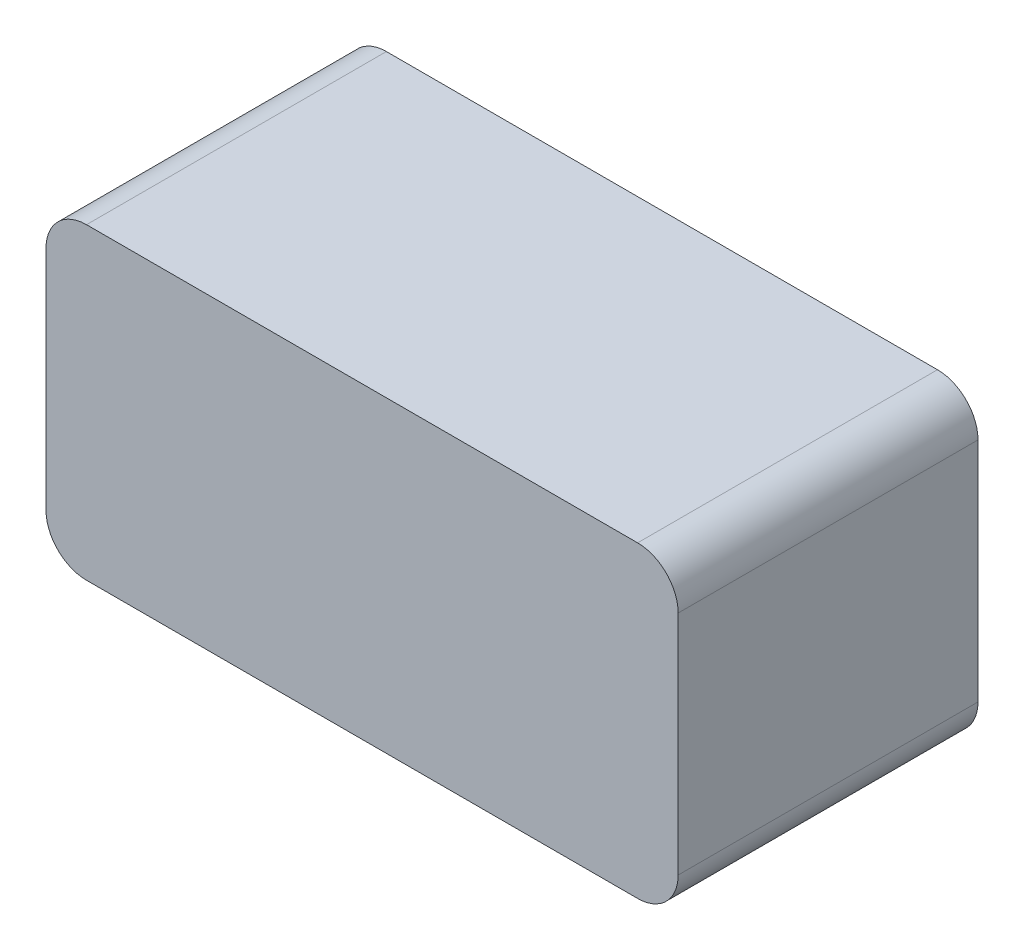
from build123d import *

# Parameters (mm, degrees)
SKETCH1_W           = 78
SKETCH1_H           = 37
BOSS_EXTRUDE1_DEPTH = 38
FILLET1_R           = 5


with BuildPart() as part:
    # Sketch1 → Boss-Extrude1 (new body)
    with BuildSketch(Plane(origin=(0, 0, 0), x_dir=(1, 0, 0), z_dir=(0, 1, 0))):
        with Locations((39, 18.5)):
            Rectangle(SKETCH1_W, SKETCH1_H)
    extrude(amount=BOSS_EXTRUDE1_DEPTH)

    # Fillet1
    fillet1_edges = [part.edges().sort_by_distance(p)[0] for p in [
        (78, 38, -18.5),
        (0, 38, -18.5),
        (78, 0, -18.5),
        (0, 0, -18.5),
    ]]
    fillet(fillet1_edges, radius=FILLET1_R)


solid = part.part
